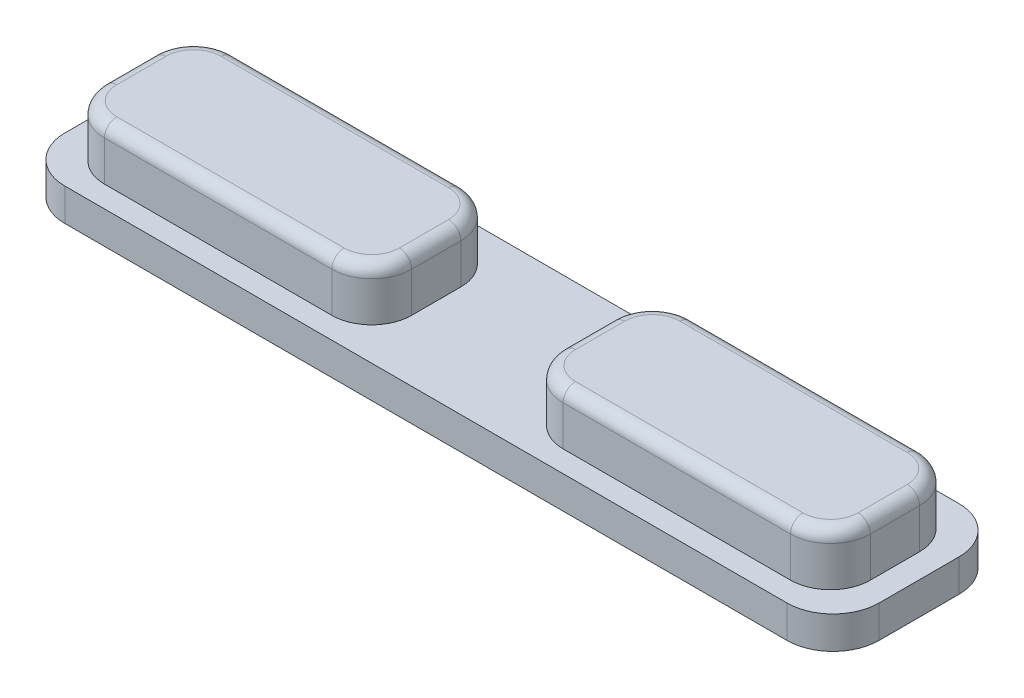
from build123d import *

# Parameters (mm, degrees)
SKETCH1_W            = 26.5
SKETCH1_H            = 5.6
BOSS_EXTRUDE1_DEPTH  = 1.056
SKETCH2_W            = 10
SKETCH2_H            = 4.2
BOSS_EXTRUDE2_DEPTH  = 1.7
FILLET1_R            = 1.5
FILLET2_R            = 1.3
FILLET3_R            = 0.4
FILLET2_OF_MIRROR2_R = 1.3
FILLET3_OF_MIRROR2_R = 0.4


with BuildPart() as part:
    # Sketch1 → Boss-Extrude1 (new body)
    with BuildSketch(Plane(origin=(0, 0, 0), x_dir=(1, 0, 0), z_dir=(0, 1, 0))):
        Rectangle(SKETCH1_W, SKETCH1_H)
    extrude(amount=BOSS_EXTRUDE1_DEPTH)

    # Sketch2 → Boss-Extrude2 (add)
    with BuildSketch(Plane(origin=(0, 1.056, 0), x_dir=(1, 0, 0), z_dir=(0, 1, 0))):
        with Locations((7.465, 0)):
            Rectangle(SKETCH2_W, SKETCH2_H)
    boss_extrude2 = extrude(amount=BOSS_EXTRUDE2_DEPTH)

    # Fillet1
    fillet1_edges = [part.edges().sort_by_distance(p)[0] for p in [
        (13.25, 0.528, 2.8),
        (-13.25, 0.528, 2.8),
        (-13.25, 0.528, -2.8),
        (13.25, 0.528, -2.8),
    ]]
    fillet(fillet1_edges, radius=FILLET1_R)

    # Fillet2
    fillet2_edges = [part.edges().sort_by_distance(p)[0] for p in [
        (12.465, 1.906, 2.1),
        (12.465, 1.906, -2.1),
        (2.465, 1.906, -2.1),
        (2.465, 1.906, 2.1),
    ]]
    fillet(fillet2_edges, radius=FILLET2_R)

    # Fillet3
    fillet3_edges = [part.edges().sort_by_distance(p)[0] for p in [
        (2.465, 2.756, 0),
        (7.465, 2.756, -2.1),
        (12.465, 2.756, 0),
        (7.465, 2.756, 2.1),
        (2.845761184, 2.756, 1.719238816),
        (12.084238816, 2.756, 1.719238816),
        (12.084238816, 2.756, -1.719238816),
        (2.845761184, 2.756, -1.719238816),
    ]]
    fillet(fillet3_edges, radius=FILLET3_R)

    # Mirror2: Boss-Extrude2 across plane
    add(boss_extrude2.mirror(Plane(origin=(0, 0, 0), x_dir=(0, 0, 1), z_dir=(1, 0, 0))))

    # Fillet2 of Mirror2
    fillet2_of_mirror2_edges = [part.edges().sort_by_distance(p)[0] for p in [
        (-12.465, 1.906, 2.1),
        (-12.465, 1.906, -2.1),
        (-2.465, 1.906, -2.1),
        (-2.465, 1.906, 2.1),
    ]]
    fillet(fillet2_of_mirror2_edges, radius=FILLET2_OF_MIRROR2_R)

    # Fillet3 of Mirror2
    fillet3_of_mirror2_edges = [part.edges().sort_by_distance(p)[0] for p in [
        (-2.465, 2.756, 0),
        (-7.465, 2.756, -2.1),
        (-12.465, 2.756, 0),
        (-7.465, 2.756, 2.1),
        (-2.845761184, 2.756, 1.719238816),
        (-12.084238816, 2.756, 1.719238816),
        (-12.084238816, 2.756, -1.719238816),
        (-2.845761184, 2.756, -1.719238816),
    ]]
    fillet(fillet3_of_mirror2_edges, radius=FILLET3_OF_MIRROR2_R)


solid = part.part
